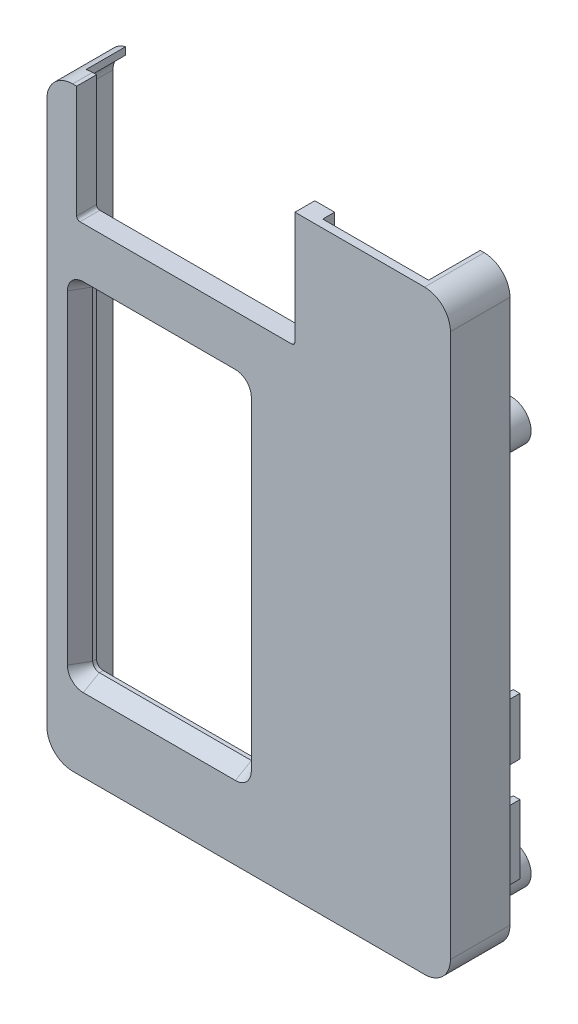
from build123d import *
from OCP.BRepFilletAPI import BRepFilletAPI_MakeChamfer

# Parameters (mm, degrees)
SKETCH_1_W          = 61
SKETCH_1_H          = 90
EXTRUDE_1_DEPTH     = 3
SKETCH_3_W          = 25
SKETCH_3_H          = 51
CUT_EXTRUDE_1_DEPTH = 3
FILLET_1_R          = 1
CHAMFER_1_SIZE      = 1.4
CHAMFER_1_SIZE2     = 2.424871131
SKETCH_7_R          = 3
EXTRUDE_2_DEPTH     = 12.2
CHAMFER_2_SIZE      = 1
CHAMFER_2_SIZE2     = 2.747477419
SKETCH_8_R          = 1.3
CUT_EXTRUDE_2_DEPTH = 6
CHAMFER_3_SIZE      = 0.4
CHAMFER_3_SIZE2     = 1.098990968
SKETCH_10_W         = 1
SKETCH_10_H         = 10.4
SKETCH_10_H_2       = 8.6
EXTRUDE_3_DEPTH     = 8.5
SKETCH_11_W         = 61
SKETCH_11_H         = 90
SKETCH_11_W_2       = 59
SKETCH_11_H_2       = 88
EXTRUDE_4_DEPTH     = 6
FILLET_2_R          = 3.1
FILLET_3_R          = 3.9
CUT_EXTRUDE_3_DEPTH = 6
SKETCH_13_W         = 33
SKETCH_13_H         = 17.5
CUT_EXTRUDE_4_DEPTH = 3
FILLET_4_R          = 0.5
SKETCH_14_W         = 16
SKETCH_14_H         = 21.5
CUT_EXTRUDE_5_DEPTH = 1.8
SKETCH_15_W         = 2.5
SKETCH_15_H         = 8.6
CUT_EXTRUDE_6_DEPTH = 1


with BuildPart() as part:
    # 草图1 → 凸台-拉伸1 (new body)
    with BuildSketch(Plane.XY):
        Rectangle(SKETCH_1_W, SKETCH_1_H)
    extrude(amount=EXTRUDE_1_DEPTH)

    # 草图3 → 切除-拉伸1 (cut)
    with BuildSketch(Plane.XY.offset(3)):
        with Locations((-13.5, -7)):
            Rectangle(SKETCH_3_W, SKETCH_3_H)
    extrude(amount=-CUT_EXTRUDE_1_DEPTH, mode=Mode.SUBTRACT)

    # 圆角1
    fillet_1_edges = [part.edges().sort_by_distance(p)[0] for p in [
        (-1, -32.5, 1.5),
        (-1, 18.5, 1.5),
        (-26, 18.5, 1.5),
        (-26, -32.5, 1.5),
    ]]
    fillet(fillet_1_edges, radius=FILLET_1_R)

    # 倒角1
    chamfer_1_edges = [part.edges().sort_by_distance(p)[0] for p in [
        (-13.5, 18.5, 3),
        (-1, -7, 3),
        (-13.5, -32.5, 3),
        (-26, -7, 3),
        (-1.292893219, 18.207106781, 3),
        (-1.292893219, -32.207106781, 3),
        (-25.707106781, -32.207106781, 3),
        (-25.707106781, 18.207106781, 3),
    ]]
    chamfer_1_side = [part.faces().sort_by_distance(p)[0] for p in [
        (4.080049622, 2.115581285, 3),
    ]]
    chamfer(chamfer_1_edges, length=CHAMFER_1_SIZE, length2=CHAMFER_1_SIZE2, reference=chamfer_1_side[0])

    # 草图7 → 凸台-拉伸2 (add)
    with BuildSketch(Plane(origin=(0, 0, 0), x_dir=(-1, 0, 0), z_dir=(0, 0, -1))):
        with Locations((-24.5, -39)):
            Circle(SKETCH_7_R)
        with Locations((-24.5, 19)):
            Circle(SKETCH_7_R)
    extrude(amount=EXTRUDE_2_DEPTH)

    # 倒角2
    chamfer_2_edges = [part.edges().sort_by_distance(p)[0] for p in [
        (27.5, -39, 0),
        (27.5, 19, 0),
    ]]
    chamfer_2_side = [part.faces().sort_by_distance(p)[0] for p in [
        (3.802426395, 2.28030092, 0),
    ]]
    chamfer(chamfer_2_edges, length=CHAMFER_2_SIZE, length2=CHAMFER_2_SIZE2, reference=chamfer_2_side[0])

    # 草图8 → 切除-拉伸2 (cut)
    with BuildSketch(Plane(origin=(0, 0, -12.2), x_dir=(-1, 0, 0), z_dir=(0, 0, -1))):
        with Locations((-24.5, 19)):
            Circle(SKETCH_8_R)
        with Locations((-24.5, -39)):
            Circle(SKETCH_8_R)
    extrude(amount=-CUT_EXTRUDE_2_DEPTH, mode=Mode.SUBTRACT)

    # 倒角3: one chamfer whose edges measure the first distance from different faces: ONE call of the kernel's chamfer builder (chamfer() names one face for all edges)
    chamfer_3_edges_1 = [part.edges().sort_by_distance(p)[0] for p in [
        (25.8, 19, -12.2),
    ]]
    chamfer_3_side_1 = [part.faces().sort_by_distance(p)[0] for p in [
        (27.415147186, 19, -12.2),
    ]]
    chamfer_3_edges_2 = [part.edges().sort_by_distance(p)[0] for p in [
        (25.8, -39, -12.2),
    ]]
    chamfer_3_side_2 = [part.faces().sort_by_distance(p)[0] for p in [
        (27.415147186, -39, -12.2),
    ]]
    chamfer_3 = BRepFilletAPI_MakeChamfer(part.part.solid().wrapped)
    for e in chamfer_3_edges_1:
        chamfer_3.Add(CHAMFER_3_SIZE, CHAMFER_3_SIZE2, e.wrapped, chamfer_3_side_1[0].wrapped)  # the first distance lies on this face
    for e in chamfer_3_edges_2:
        chamfer_3.Add(CHAMFER_3_SIZE, CHAMFER_3_SIZE2, e.wrapped, chamfer_3_side_2[0].wrapped)  # the first distance lies on this face
    add(Compound.cast(chamfer_3.Shape()), mode=Mode.REPLACE)

    # 草图10 → 凸台-拉伸3 (add)
    with BuildSketch(Plane(origin=(0, 0, 0), x_dir=(-1, 0, 0), z_dir=(0, 0, -1))):
        with Locations((-29, -31.6)):
            Rectangle(SKETCH_10_W, SKETCH_10_H)
        with Locations((-29, -16.8)):
            Rectangle(SKETCH_10_W, SKETCH_10_H_2)
        with Locations((-29, -3)):
            Rectangle(SKETCH_10_W, SKETCH_10_H_2)
    extrude(amount=EXTRUDE_3_DEPTH)

    # 草图11 → 凸台-拉伸4 (add)
    with BuildSketch(Plane(origin=(0, 0, 0), x_dir=(-1, 0, 0), z_dir=(0, 0, -1))):
        Rectangle(SKETCH_11_W, SKETCH_11_H)
        Rectangle(SKETCH_11_W_2, SKETCH_11_H_2, mode=Mode.SUBTRACT)
    extrude(amount=EXTRUDE_4_DEPTH)

    # 圆角2
    fillet_2_edges = [part.edges().sort_by_distance(p)[0] for p in [
        (29.5, -44, -3),
        (29.5, 44, -3),
        (-29.5, -44, -3),
        (-29.5, 44, -3),
    ]]
    fillet(fillet_2_edges, radius=FILLET_2_R)

    # 圆角3
    fillet_3_edges = [part.edges().sort_by_distance(p)[0] for p in [
        (30.5, -45, -1.5),
        (-30.5, -45, -1.5),
        (-30.5, 45, -1.5),
        (30.5, 45, -1.5),
    ]]
    fillet(fillet_3_edges, radius=FILLET_3_R)

    # 草图12 → 切除-拉伸3 (cut)
    with BuildSketch(Plane(origin=(0, 0, -6), x_dir=(-1, 0, 0), z_dir=(0, 0, -1))):
        with BuildLine():
            Line((-26, 45), (27.6, 45))
            Line((27.6, 45), (27.6, 43.758321186))
            ThreePointArc((27.6, 43.758321186), (27.012047516, 43.938979736), (26.4, 44))
            Line((26.4, 44), (-26, 44))
            Line((-26, 44), (-26, 45))
        make_face()
    extrude(amount=-CUT_EXTRUDE_3_DEPTH, mode=Mode.SUBTRACT)

    # 草图13 → 切除-拉伸4 (cut)
    with BuildSketch(Plane.XY.offset(3)):
        with Locations((-9.5, 36.25)):
            Rectangle(SKETCH_13_W, SKETCH_13_H)
    extrude(amount=-CUT_EXTRUDE_4_DEPTH, mode=Mode.SUBTRACT)

    # 圆角4
    fillet_4_edges = [part.edges().sort_by_distance(p)[0] for p in [
        (7, 27.5, 1.5),
        (-26, 27.5, 1.5),
    ]]
    fillet(fillet_4_edges, radius=FILLET_4_R)

    # 草图14 → 切除-拉伸5 (cut)
    with BuildSketch(Plane(origin=(0, 0, 0), x_dir=(-1, 0, 0), z_dir=(0, 0, -1))):
        with Locations((-18, 34.25)):
            Rectangle(SKETCH_14_W, SKETCH_14_H)
    extrude(amount=-CUT_EXTRUDE_5_DEPTH, mode=Mode.SUBTRACT)

    # 草图15 → 切除-拉伸6 (cut)
    with BuildSketch(Plane(origin=(29.5, 0, 0), x_dir=(0, 0, -1), z_dir=(1, 0, 0))):
        with Locations((7.25, -3)):
            Rectangle(SKETCH_15_W, SKETCH_15_H)
    extrude(amount=-CUT_EXTRUDE_6_DEPTH, mode=Mode.SUBTRACT)


solid = part.part
